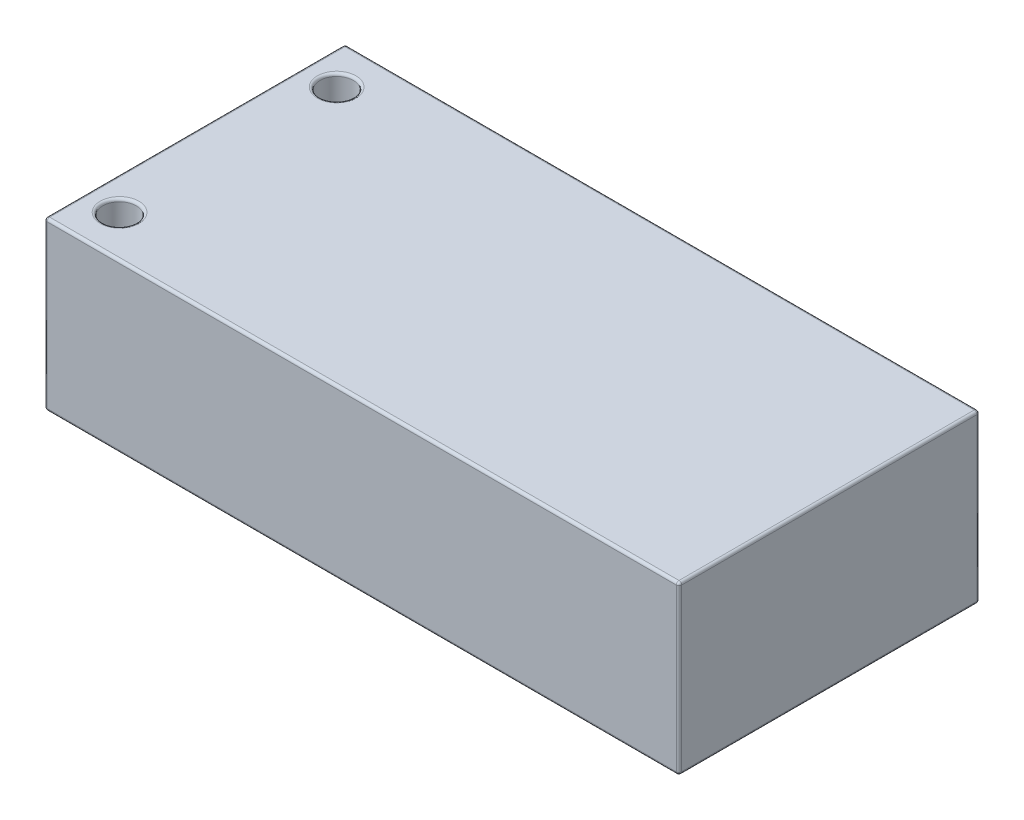
from build123d import *

# Parameters (mm, degrees)
SKETCH1_W           = 95
SKETCH1_H           = 45
BOSS_EXTRUDE1_DEPTH = 25
SKETCH2_R           = 2.5
CUT_EXTRUDE1_DEPTH  = 10
FILLET1_R           = 0.4


with BuildPart() as part:
    # Sketch1 → Boss-Extrude1 (new body)
    with BuildSketch(Plane(origin=(0, 0, 0), x_dir=(1, 0, 0), z_dir=(0, 1, 0))):
        with Locations((47.5, 22.5)):
            Rectangle(SKETCH1_W, SKETCH1_H)
    extrude(amount=BOSS_EXTRUDE1_DEPTH)

    # Sketch2 → Cut-Extrude1 (cut)
    with BuildSketch(Plane(origin=(0, 25, 0), x_dir=(1, 0, 0), z_dir=(0, 1, 0))):
        with Locations(Location((5, 38.75, 0), (0, 0, 270))):
            Circle(SKETCH2_R)
        with Locations(Location((5, 6.25, 0), (0, 0, 270))):
            Circle(SKETCH2_R)
    extrude(amount=-CUT_EXTRUDE1_DEPTH, mode=Mode.SUBTRACT)

    # Fillet1
    fillet1_edges = [part.edges().sort_by_distance(p)[0] for p in [
        (95, 25, -22.5),
        (5, 25, -41.25),
        (47.5, 25, -45),
        (5, 25, -8.75),
        (0, 25, -22.5),
        (47.5, 0, -45),
        (95, 0, -22.5),
        (47.5, 0, 0),
        (0, 0, -22.5),
        (0, 12.5, -45),
        (95, 12.5, -45),
        (95, 12.5, 0),
        (0, 12.5, 0),
        (47.5, 25, 0),
    ]]
    fillet(fillet1_edges, radius=FILLET1_R)


solid = part.part
